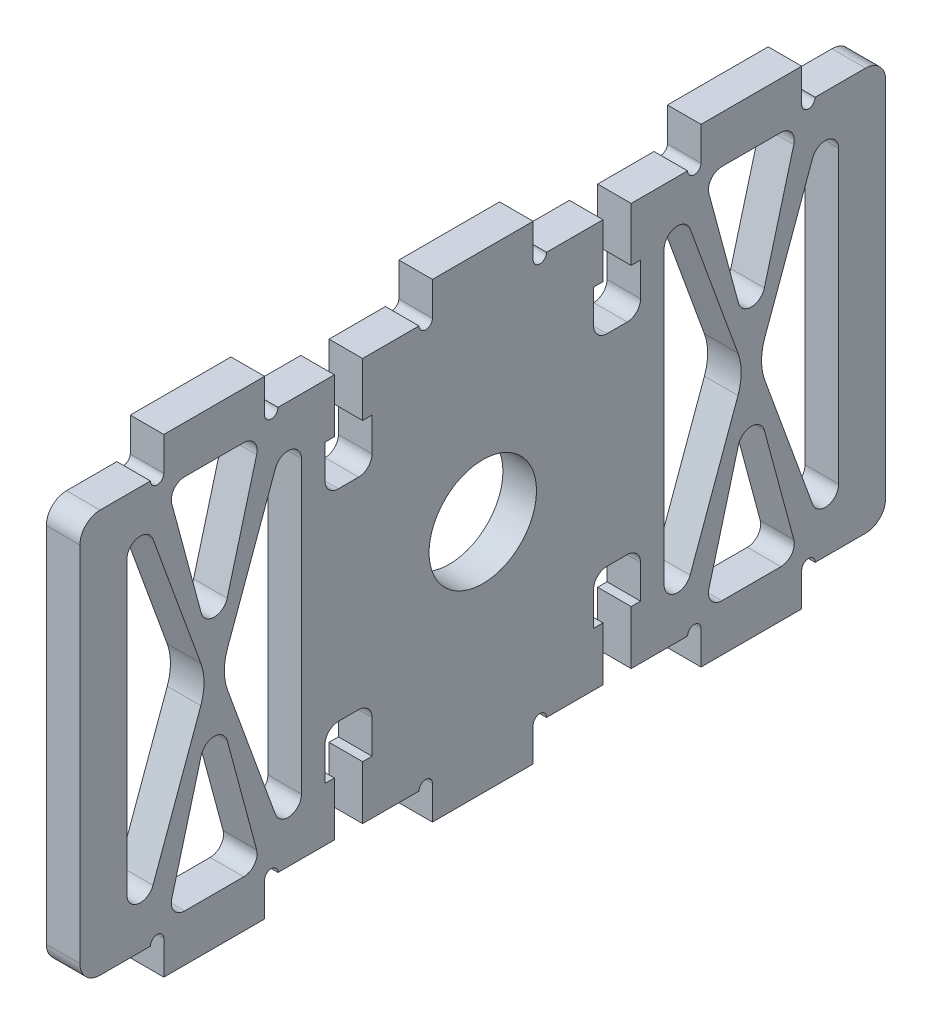
from build123d import *

# Parameters (mm, degrees)
SKETCH_1_W          = 120
SKETCH_1_H          = 60
EXTRUDE_1_DEPTH     = 5
SKETCH_2_R          = 8
CUT_EXTRUDE_1_DEPTH = 5
SKETCH_3_W          = 15
SKETCH_3_H          = 5
EXTRUDE_2_DEPTH     = 5
CUT_EXTRUDE_2_DEPTH = 5
CUT_EXTRUDE_3_DEPTH = 10
FILLET_1_R          = 3
CUT_EXTRUDE_4_DEPTH = 10
FILLET_2_R          = 2


with BuildPart() as part:
    # 草图1 → 凸台-拉伸1 (new body)
    with BuildSketch(Plane(origin=(0, 0, 0), x_dir=(0, 0, -1), z_dir=(1, 0, 0))):
        Rectangle(SKETCH_1_W, SKETCH_1_H)
    extrude(amount=EXTRUDE_1_DEPTH)

    # 草图2 → 切除-拉伸1 (cut, symmetric)
    with BuildSketch(Plane(origin=(5, 0, 0), x_dir=(0, 0, -1), z_dir=(1, 0, 0))):
        Circle(SKETCH_2_R)
    extrude(amount=CUT_EXTRUDE_1_DEPTH, both=True, mode=Mode.SUBTRACT)

    # 草图3 → 凸台-拉伸2 (add)
    with BuildSketch(Plane(origin=(5, 0, 0), x_dir=(0, 0, -1), z_dir=(1, 0, 0))):
        with Locations((0, 32.5)):
            Rectangle(SKETCH_3_W, SKETCH_3_H)
        with Locations((-40, 32.5)):
            Rectangle(SKETCH_3_W, SKETCH_3_H)
        with Locations((40, 32.5)):
            Rectangle(SKETCH_3_W, SKETCH_3_H)
        with Locations((40, -32.5)):
            Rectangle(SKETCH_3_W, SKETCH_3_H)
        with Locations((-40, -32.5)):
            Rectangle(SKETCH_3_W, SKETCH_3_H)
        with Locations((0, -32.5)):
            Rectangle(SKETCH_3_W, SKETCH_3_H)
    extrude(amount=-EXTRUDE_2_DEPTH)

    # 草图4 → 切除-拉伸2 (cut)
    with BuildSketch(Plane(origin=(5, 0, 0), x_dir=(0, 0, -1), z_dir=(1, 0, 0))):
        Polygon((-22.1, 30), (-22.1, 22), (-23.5, 22), (-23.5, 15), (-16.5, 15), (-16.5, 22), (-17.9, 22), (-17.9, 30), align=None)
        Polygon((17.9, 30), (17.9, 22), (16.5, 22), (16.5, 15), (23.5, 15), (23.5, 22), (22.1, 22), (22.1, 30), align=None)
        Polygon((22.1, -30), (22.1, -22), (23.5, -22), (23.5, -15), (16.5, -15), (16.5, -22), (17.9, -22), (17.9, -30), align=None)
        Polygon((-17.9, -30), (-17.9, -22), (-16.5, -22), (-16.5, -15), (-23.5, -15), (-23.5, -22), (-22.1, -22), (-22.1, -30), align=None)
    extrude(amount=-CUT_EXTRUDE_2_DEPTH, mode=Mode.SUBTRACT)

    # 草图5 → 切除-拉伸3 (cut)
    with BuildSketch(Plane(origin=(5, 0, 0), x_dir=(0, 0, -1), z_dir=(1, 0, 0))):
        with BuildLine():
            Line((-46.321552745, 25.480053053), (-41.931231517, 9.173145635))
            ThreePointArc((-41.931231517, 9.173145635), (-40, 7.693092582), (-38.068768483, 9.173145635))
            Line((-38.068768483, 9.173145635), (-33.678447255, 25.480053053))
            ThreePointArc((-33.678447255, 25.480053053), (-34.022244696, 27.216574311), (-35.609678772, 28))
            Line((-35.609678772, 28), (-44.390321228, 28))
            ThreePointArc((-44.390321228, 28), (-45.977755304, 27.216574311), (-46.321552745, 25.480053053))
        make_face()
        with BuildLine():
            Line((-49.120413153, 22.331136171), (-41.994161638, 2.733944505))
            ThreePointArc((-41.994161638, 2.733944505), (-41.512509026, 0), (-41.994161638, -2.733944505))
            Line((-41.994161638, -2.733944505), (-49.120413153, -22.331136171))
            ThreePointArc((-49.120413153, -22.331136171), (-51.347005984, -23.617316729), (-53, -21.647650045))
            Line((-53, -21.647650045), (-53, 21.647650045))
            ThreePointArc((-53, 21.647650045), (-51.347005984, 23.617316729), (-49.120413153, 22.331136171))
        make_face()
        with BuildLine():
            Line((-38.068768483, -9.173145635), (-33.678447255, -25.480053053))
            ThreePointArc((-33.678447255, -25.480053053), (-34.022244696, -27.216574311), (-35.609678772, -28))
            Line((-35.609678772, -28), (-44.390321228, -28))
            ThreePointArc((-44.390321228, -28), (-45.977755304, -27.216574311), (-46.321552745, -25.480053053))
            Line((-46.321552745, -25.480053053), (-41.931231517, -9.173145635))
            ThreePointArc((-41.931231517, -9.173145635), (-40, -7.693092582), (-38.068768483, -9.173145635))
        make_face()
        with BuildLine():
            Line((-38.005838362, -2.733944505), (-30.879586847, -22.331136171))
            ThreePointArc((-30.879586847, -22.331136171), (-28.652994016, -23.617316729), (-27, -21.647650045))
            Line((-27, -21.647650045), (-27, 21.647650045))
            ThreePointArc((-27, 21.647650045), (-28.652994016, 23.617316729), (-30.879586847, 22.331136171))
            Line((-30.879586847, 22.331136171), (-38.005838362, 2.733944505))
            ThreePointArc((-38.005838362, 2.733944505), (-38.487490974, 0), (-38.005838362, -2.733944505))
        make_face()
        with BuildLine():
            Line((27, -21.647650045), (27, 21.647650045))
            ThreePointArc((27, 21.647650045), (28.652994016, 23.617316729), (30.879586847, 22.331136171))
            Line((30.879586847, 22.331136171), (38.005838362, 2.733944505))
            ThreePointArc((38.005838362, 2.733944505), (38.487490974, 0), (38.005838362, -2.733944505))
            Line((38.005838362, -2.733944505), (30.879586847, -22.331136171))
            ThreePointArc((30.879586847, -22.331136171), (28.652994016, -23.617316729), (27, -21.647650045))
        make_face()
        with BuildLine():
            Line((35.609678772, -28), (44.390321228, -28))
            ThreePointArc((44.390321228, -28), (45.977755304, -27.216574311), (46.321552745, -25.480053053))
            Line((46.321552745, -25.480053053), (41.931231517, -9.173145635))
            ThreePointArc((41.931231517, -9.173145635), (40, -7.693092582), (38.068768483, -9.173145635))
            Line((38.068768483, -9.173145635), (33.678447255, -25.480053053))
            ThreePointArc((33.678447255, -25.480053053), (34.022244696, -27.216574311), (35.609678772, -28))
        make_face()
        with BuildLine():
            Line((53, -21.647650045), (53, 21.647650045))
            ThreePointArc((53, 21.647650045), (51.347005984, 23.617316729), (49.120413153, 22.331136171))
            Line((49.120413153, 22.331136171), (41.994161638, 2.733944505))
            ThreePointArc((41.994161638, 2.733944505), (41.512509026, 0), (41.994161638, -2.733944505))
            Line((41.994161638, -2.733944505), (49.120413153, -22.331136171))
            ThreePointArc((49.120413153, -22.331136171), (51.347005984, -23.617316729), (53, -21.647650045))
        make_face()
        with BuildLine():
            Line((35.609678772, 28), (44.390321228, 28))
            ThreePointArc((44.390321228, 28), (45.977755304, 27.216574311), (46.321552745, 25.480053053))
            Line((46.321552745, 25.480053053), (41.931231517, 9.173145635))
            ThreePointArc((41.931231517, 9.173145635), (40, 7.693092582), (38.068768483, 9.173145635))
            Line((38.068768483, 9.173145635), (33.678447255, 25.480053053))
            ThreePointArc((33.678447255, 25.480053053), (34.022244696, 27.216574311), (35.609678772, 28))
        make_face()
    extrude(amount=-CUT_EXTRUDE_3_DEPTH, mode=Mode.SUBTRACT)

    # 圆角1
    fillet_1_edges = [part.edges().sort_by_distance(p)[0] for p in [
        (2.5, 30, 60),
        (2.5, 30, -60),
        (2.5, -30, -60),
        (2.5, -30, 60),
    ]]
    fillet(fillet_1_edges, radius=FILLET_1_R)

    # 草图6 → 切除-拉伸4 (cut)
    with BuildSketch(Plane(origin=(5, 0, 0), x_dir=(0, 0, -1), z_dir=(1, 0, 0))):
        with BuildLine():
            Line((-49.5, 30), (-47.5, 30))
            ThreePointArc((-47.5, 30), (-48.5, 29), (-49.5, 30))
        make_face()
        with BuildLine():
            Line((-32.5, 30), (-30.5, 30))
            ThreePointArc((-30.5, 30), (-31.5, 29), (-32.5, 30))
        make_face()
        with BuildLine():
            Line((-9.5, 30), (-7.5, 30))
            ThreePointArc((-7.5, 30), (-8.5, 29), (-9.5, 30))
        make_face()
        with BuildLine():
            Line((7.5, 30), (9.5, 30))
            ThreePointArc((9.5, 30), (8.5, 29), (7.5, 30))
        make_face()
        with BuildLine():
            Line((30.5, 30), (32.5, 30))
            ThreePointArc((32.5, 30), (31.5, 29), (30.5, 30))
        make_face()
        with BuildLine():
            Line((47.5, 30), (49.5, 30))
            ThreePointArc((49.5, 30), (48.5, 29), (47.5, 30))
        make_face()
        with BuildLine():
            Line((47.5, -30), (49.5, -30))
            ThreePointArc((49.5, -30), (48.5, -29), (47.5, -30))
        make_face()
        with BuildLine():
            Line((30.5, -30), (32.5, -30))
            ThreePointArc((32.5, -30), (31.5, -29), (30.5, -30))
        make_face()
        with BuildLine():
            Line((7.5, -30), (9.5, -30))
            ThreePointArc((9.5, -30), (8.5, -29), (7.5, -30))
        make_face()
        with BuildLine():
            Line((-9.5, -30), (-7.5, -30))
            ThreePointArc((-7.5, -30), (-8.5, -29), (-9.5, -30))
        make_face()
        with BuildLine():
            Line((-32.5, -30), (-30.5, -30))
            ThreePointArc((-30.5, -30), (-31.5, -29), (-32.5, -30))
        make_face()
        with BuildLine():
            Line((-49.5, -30), (-47.5, -30))
            ThreePointArc((-47.5, -30), (-48.5, -29), (-49.5, -30))
        make_face()
    extrude(amount=-CUT_EXTRUDE_4_DEPTH, mode=Mode.SUBTRACT)

    # 圆角2
    fillet_2_edges = [part.edges().sort_by_distance(p)[0] for p in [
        (2.5, -15, 23.5),
        (2.5, -15, 16.5),
        (2.5, -15, -16.5),
        (2.5, -15, -23.5),
        (2.5, 15, -23.5),
        (2.5, 15, -16.5),
        (2.5, 15, 16.5),
        (2.5, 15, 23.5),
    ]]
    fillet(fillet_2_edges, radius=FILLET_2_R)


solid = part.part
